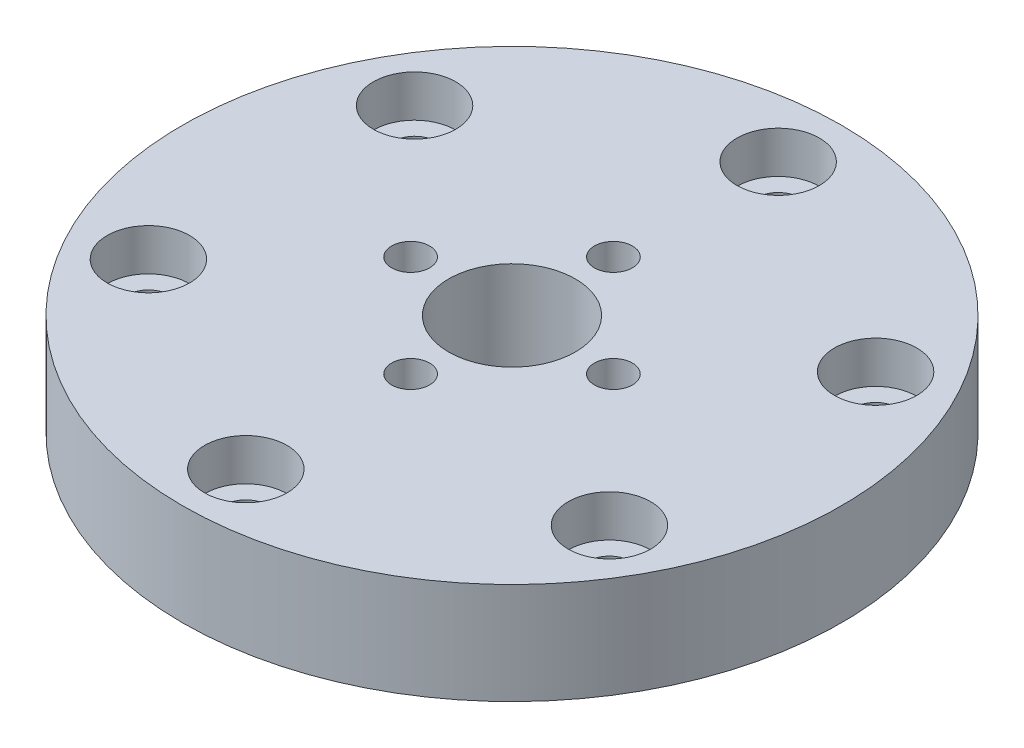
from build123d import *

# Parameters (mm, degrees)
SKETCH_2_R          = 26
SKETCH_2_R_2        = 5
SKETCH_2_R_3        = 1.5
SKETCH_2_R_4        = 1.7
EXTRUDE_1_DEPTH     = 8
SKETCH_3_R          = 3.25
CUT_EXTRUDE_1_DEPTH = 3.3


with BuildPart() as part:
    # 草图2 → 凸台-拉伸1 (new body)
    with BuildSketch(Plane(origin=(0, 0, 0), x_dir=(1, 0, 0), z_dir=(0, 1, 0))):
        with Locations(Location((0, 0, 0), (0, 0, 270))):
            Circle(SKETCH_2_R)
        with Locations(Location((0, 0, 0), (0, 0, 270))):
            Circle(SKETCH_2_R_2, mode=Mode.SUBTRACT)
        with Locations(Location((0, 8, 0), (0, 0, 270))):
            Circle(SKETCH_2_R_3, mode=Mode.SUBTRACT)
        with Locations(Location((8, 0, 0), (0, 0, 270))):
            Circle(SKETCH_2_R_3, mode=Mode.SUBTRACT)
        with Locations(Location((0, -8, 0), (0, 0, 270))):
            Circle(SKETCH_2_R_3, mode=Mode.SUBTRACT)
        with Locations(Location((-8, 0, 0), (0, 0, 270))):
            Circle(SKETCH_2_R_3, mode=Mode.SUBTRACT)
        with Locations(Location((0, 21, 0), (0, 0, 270))):
            Circle(SKETCH_2_R_4, mode=Mode.SUBTRACT)
        with Locations(Location((18.186533479, 10.5, 0), (0, 0, 270))):
            Circle(SKETCH_2_R_4, mode=Mode.SUBTRACT)
        with Locations(Location((18.186533479, -10.5, 0), (0, 0, 270))):
            Circle(SKETCH_2_R_4, mode=Mode.SUBTRACT)
        with Locations(Location((0, -21, 0), (0, 0, 270))):
            Circle(SKETCH_2_R_4, mode=Mode.SUBTRACT)
        with Locations(Location((-18.186533479, -10.5, 0), (0, 0, 270))):
            Circle(SKETCH_2_R_4, mode=Mode.SUBTRACT)
        with Locations(Location((-18.186533479, 10.5, 0), (0, 0, 270))):
            Circle(SKETCH_2_R_4, mode=Mode.SUBTRACT)
    extrude(amount=EXTRUDE_1_DEPTH)

    # 草图3 → 切除-拉伸1 (cut)
    with BuildSketch(Plane(origin=(0, 8, 0), x_dir=(1, 0, 0), z_dir=(0, 1, 0))):
        with Locations(Location((0, 21, 0), (0, 0, 270))):
            Circle(SKETCH_3_R)
        with Locations(Location((18.186533479, 10.5, 0), (0, 0, 270))):
            Circle(SKETCH_3_R)
        with Locations(Location((18.186533479, -10.5, 0), (0, 0, 270))):
            Circle(SKETCH_3_R)
        with Locations(Location((0, -21, 0), (0, 0, 270))):
            Circle(SKETCH_3_R)
        with Locations(Location((-18.186533479, -10.5, 0), (0, 0, 270))):
            Circle(SKETCH_3_R)
        with Locations(Location((-18.186533479, 10.5, 0), (0, 0, 270))):
            Circle(SKETCH_3_R)
    extrude(amount=-CUT_EXTRUDE_1_DEPTH, mode=Mode.SUBTRACT)


solid = part.part
